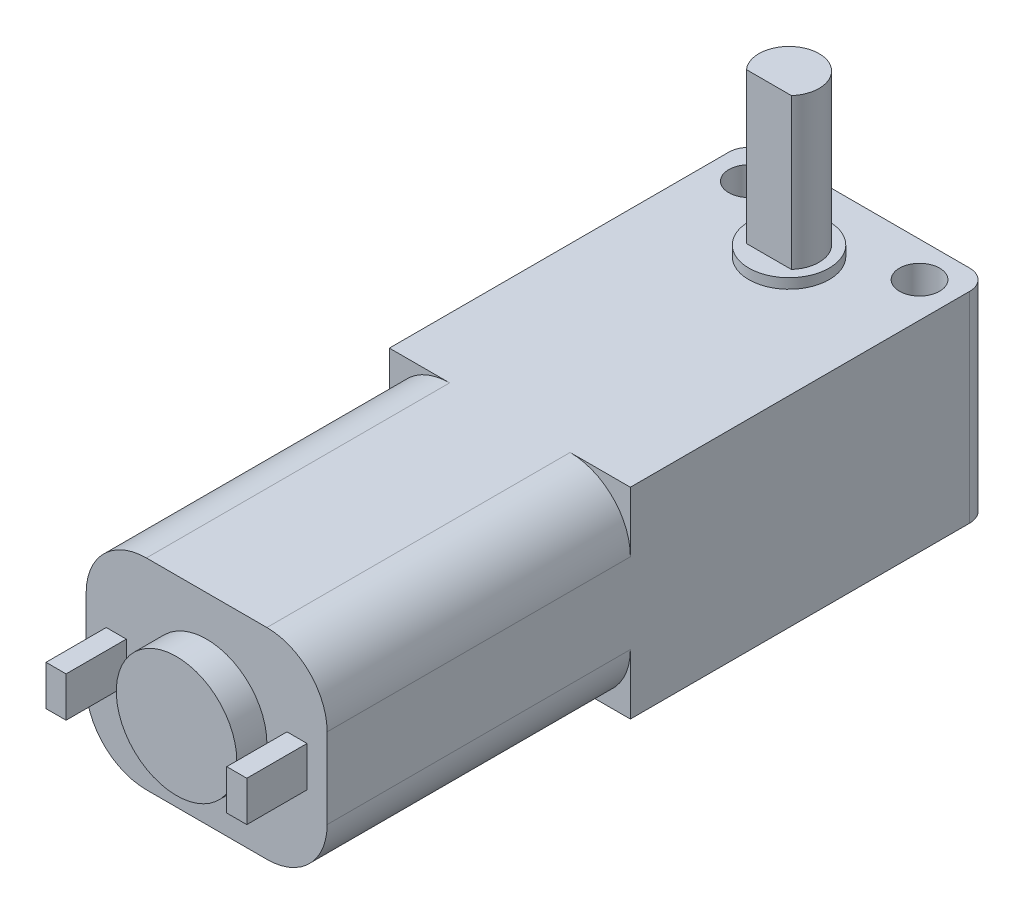
from build123d import *

# Parameters (mm, degrees)
SKETCH_1_W          = 12
SKETCH_1_H          = 33
EXTRUDE_1_DEPTH     = 10
SKETCH_3_OUTSIDE_W  = 21.302
SKETCH_3_OUTSIDE_H  = 19.302
CUT_EXTRUDE_1_DEPTH = 15.1
SKETCH_4_R          = 3
EXTRUDE_2_DEPTH     = 1.5
SKETCH_5_W          = 1
SKETCH_5_H          = 2
EXTRUDE_3_DEPTH     = 3
SKETCH_6_R          = 2
EXTRUDE_4_DEPTH     = 0.5
SKETCH_7_R          = 1.5
EXTRUDE_5_DEPTH     = 7.5
SKETCH_8_W          = 5.870249933
SKETCH_8_H          = 2.720447988
CUT_EXTRUDE_2_DEPTH = 7.5
FILLET_1_R          = 1
SKETCH_9_R          = 1
CUT_EXTRUDE_3_DEPTH = 23.721135535


with BuildPart() as part:
    # 草图1 → 凸台-拉伸1 (new body)
    with BuildSketch(Plane(origin=(0, 0, 0), x_dir=(1, 0, 0), z_dir=(0, 1, 0))):
        Rectangle(SKETCH_1_W, SKETCH_1_H)
    extrude(amount=EXTRUDE_1_DEPTH)

    # 草图3 outside → 切除-拉伸1 (cut)
    with BuildSketch(Plane.XY.offset(16.5)):
        with Locations((0, 5)):
            Rectangle(SKETCH_3_OUTSIDE_W, SKETCH_3_OUTSIDE_H)
        with BuildLine():
            Line((-3, 10), (3, 10))
            ThreePointArc((3, 10), (5.121320344, 9.121320344), (6, 7))
            Line((6, 7), (6, 3))
            ThreePointArc((6, 3), (5.121320344, 0.878679656), (3, 0))
            Line((3, 0), (-3, 0))
            ThreePointArc((-3, 0), (-5.121320344, 0.878679656), (-6, 3))
            Line((-6, 3), (-6, 7))
            ThreePointArc((-6, 7), (-5.121320344, 9.121320344), (-3, 10))
        make_face(mode=Mode.SUBTRACT)
    extrude(amount=-CUT_EXTRUDE_1_DEPTH, mode=Mode.SUBTRACT)

    # 草图4 → 凸台-拉伸2 (add)
    with BuildSketch(Plane.XY.offset(16.5)):
        with Locations((0, 5)):
            Circle(SKETCH_4_R)
    extrude(amount=EXTRUDE_2_DEPTH)

    # 草图5 → 凸台-拉伸3 (add)
    with BuildSketch(Plane.XY.offset(16.5)):
        with Locations((4.5, 5)):
            Rectangle(SKETCH_5_W, SKETCH_5_H)
        with Locations((-4.5, 5)):
            Rectangle(SKETCH_5_W, SKETCH_5_H)
    extrude(amount=EXTRUDE_3_DEPTH)

    # 草图6 → 凸台-拉伸4 (add)
    with BuildSketch(Plane(origin=(0, 10, 0), x_dir=(1, 0, 0), z_dir=(0, 1, 0))):
        with Locations(Location((0, 12.5, 0), (0, 0, 270))):
            Circle(SKETCH_6_R)
    extrude(amount=EXTRUDE_4_DEPTH)

    # 草图7 → 凸台-拉伸5 (add)
    with BuildSketch(Plane(origin=(0, 10.5, 0), x_dir=(1, 0, 0), z_dir=(0, 1, 0))):
        with Locations(Location((0, 12.5, 0), (0, 0, 270))):
            Circle(SKETCH_7_R)
    extrude(amount=EXTRUDE_5_DEPTH)

    # 草图8 → 切除-拉伸2 (cut)
    with BuildSketch(Plane(origin=(0, 18, 0), x_dir=(1, 0, 0), z_dir=(0, 1, 0))):
        with Locations((0.402921065, 10.139776006)):
            Rectangle(SKETCH_8_W, SKETCH_8_H)
    extrude(amount=-CUT_EXTRUDE_2_DEPTH, mode=Mode.SUBTRACT)

    # 圆角1
    fillet_1_edges = [part.edges().sort_by_distance(p)[0] for p in [
        (-6, 5, -16.5),
        (6, 5, -16.5),
    ]]
    fillet(fillet_1_edges, radius=FILLET_1_R)

    # 草图9 → 切除-拉伸3 (cut, through all)
    with BuildSketch(Plane(origin=(0, 10, 0), x_dir=(1, 0, 0), z_dir=(0, 1, 0))):
        with Locations(Location((-4.25, 14.75, 0), (0, 0, 270))):
            Circle(SKETCH_9_R)
        with Locations(Location((4.25, 14.75, 0), (0, 0, 270))):
            Circle(SKETCH_9_R)
    extrude(amount=-CUT_EXTRUDE_3_DEPTH, mode=Mode.SUBTRACT)


solid = part.part
